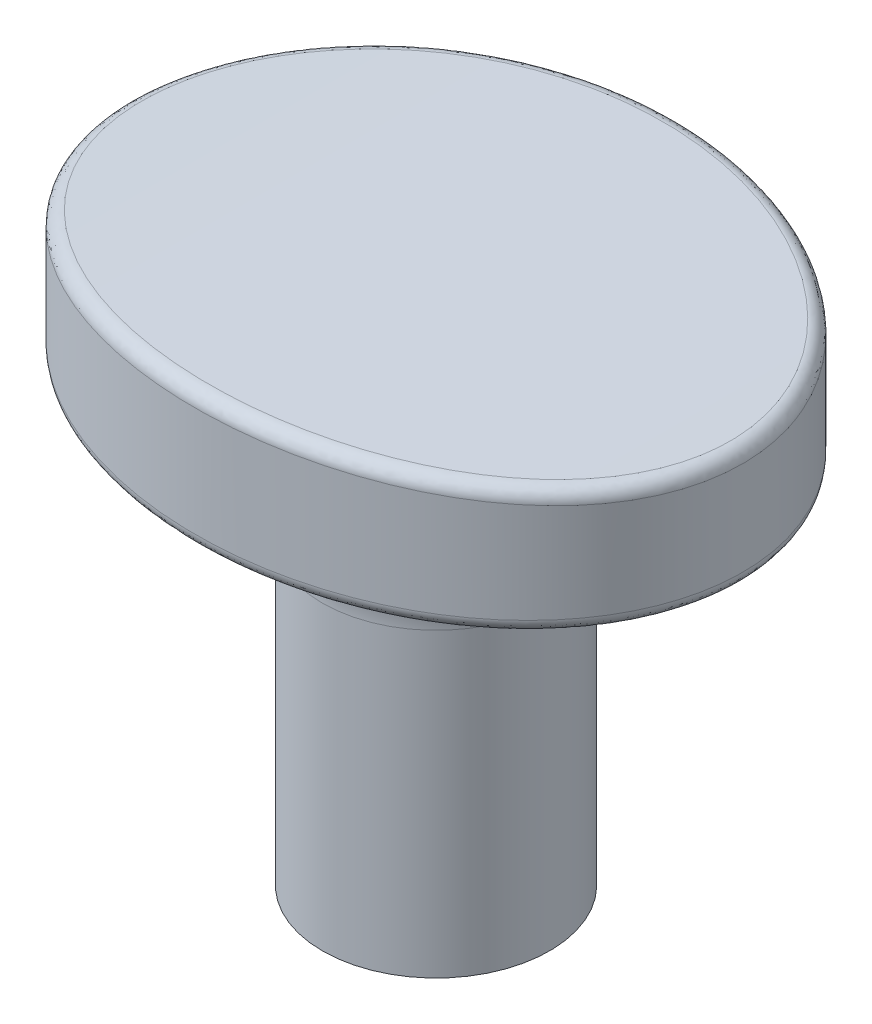
from build123d import *

# Parameters (mm, degrees)
SKETCH3_RX              = 28.448
SKETCH3_RY              = 22.352
BOSS_EXTRUDE1_DEPTH     = 12.7
CUT_EXTRUDE3_DEPTH      = 39.34306466624701
CUT_EXTRUDE3_DEPTH_BACK = 39.34306466624701
CUT_EXTRUDE4_DEPTH      = 39.343064831926725
CUT_EXTRUDE4_DEPTH_BACK = 39.343064831926725
SKETCH6_R               = 10.541000000000002
BOSS_EXTRUDE2_DEPTH     = 42.418
FILLET2_R               = 1.27
FILLET3_R               = 1.27
FILLET4_R               = 10.16
CUT_EXTRUDE7_DEPTH      = 40.64
SKETCH9_R               = 3.8099999999999996
CUT_EXTRUDE8_DEPTH      = 40.64


with BuildPart() as part:
    # Sketch3 → Boss-Extrude1 (new body)
    with BuildSketch(Plane(origin=(0, 0, 0), x_dir=(1, 0, 0), z_dir=(0, 1, 0))):
        with Locations(Location((0, 0), (0, 0, -9.31e-15))):
            Ellipse(SKETCH3_RX, SKETCH3_RY)
    extrude(amount=-BOSS_EXTRUDE1_DEPTH)

    # Sketch4 → Cut-Extrude3 (cut, two sides: drawn at the far end of the back side and taken through both)
    with BuildSketch(Plane.XY.offset(-CUT_EXTRUDE3_DEPTH_BACK)):
        with BuildLine():
            Line((-57.016183867065614, -6.350000000000001), (-57.016183867065614, 0))
            Line((-57.016183867065614, 0), (0, 0))
            ThreePointArc((0, 0), (-28.684349926236084, -1.5923924220459753), (-57.016183867065614, -6.350000000000001))
        make_face()
    extrude(amount=CUT_EXTRUDE3_DEPTH + CUT_EXTRUDE3_DEPTH_BACK, mode=Mode.SUBTRACT)

    # Sketch5 → Cut-Extrude4 (cut, two sides: drawn at the far end of the back side and taken through both)
    with BuildSketch(Plane.XY.offset(-CUT_EXTRUDE4_DEPTH_BACK)):
        with BuildLine():
            Line((57.016183867065614, -6.350000000000001), (57.016183867065614, 1.388e-14))
            Line((57.016183867065614, 1.388e-14), (0, 0))
            ThreePointArc((0, 0), (28.684349926236013, -1.5923924220459753), (57.016183867065614, -6.350000000000001))
        make_face()
    extrude(amount=CUT_EXTRUDE4_DEPTH + CUT_EXTRUDE4_DEPTH_BACK, mode=Mode.SUBTRACT)

    # Sketch6 → Boss-Extrude2 (add)
    with BuildSketch(Plane(origin=(0, -50.8, 0), x_dir=(1, 0, 0), z_dir=(0, 1, 0))):
        with Locations(Location((0, 0, 0), (0, 0, 270))):
            Circle(SKETCH6_R)
    extrude(amount=BOSS_EXTRUDE2_DEPTH)

    # Fillet2
    fillet2_edges = [part.edges().sort_by_distance(p)[0] for p in [
        (18.897313786773612, -0.6899257500063387, 16.707844987556147),
    ]]
    fillet(fillet2_edges, radius=FILLET2_R)

    # Fillet3
    fillet3_edges = [part.edges().sort_by_distance(p)[0] for p in [
        (-28.44799943216588, -12.7, 0.00446597468168338),
    ]]
    fillet(fillet3_edges, radius=FILLET3_R)

    # Fillet4
    fillet4_edges = [part.edges().sort_by_distance(p)[0] for p in [
        (5.33e-15, -12.700000000000003, -10.541000000000002),
    ]]
    fillet(fillet4_edges, radius=FILLET4_R)

    # Sketch8 → Cut-Extrude7 (cut)
    with BuildSketch(Plane(origin=(0, -50.8, 0), x_dir=(1, 0, 0), z_dir=(0, 1, 0))):
        Polygon((3.8099999999999996, 3.8099999999999996), (-3.8100000000000014, 3.8099999999999996), (-3.8099999999999996, -3.8100000000000005), (3.81, -3.8100000000000005), align=None)
    extrude(amount=CUT_EXTRUDE7_DEPTH, mode=Mode.SUBTRACT)

    # Sketch9 → Cut-Extrude8 (cut)
    with BuildSketch(Plane(origin=(0, 0, 0), x_dir=(0, 0, -1), z_dir=(1, 0, 0))):
        with Locations((5.44e-15, -44.449999999999996)):
            Circle(SKETCH9_R)
    extrude(amount=-CUT_EXTRUDE8_DEPTH, mode=Mode.SUBTRACT)


solid = part.part
